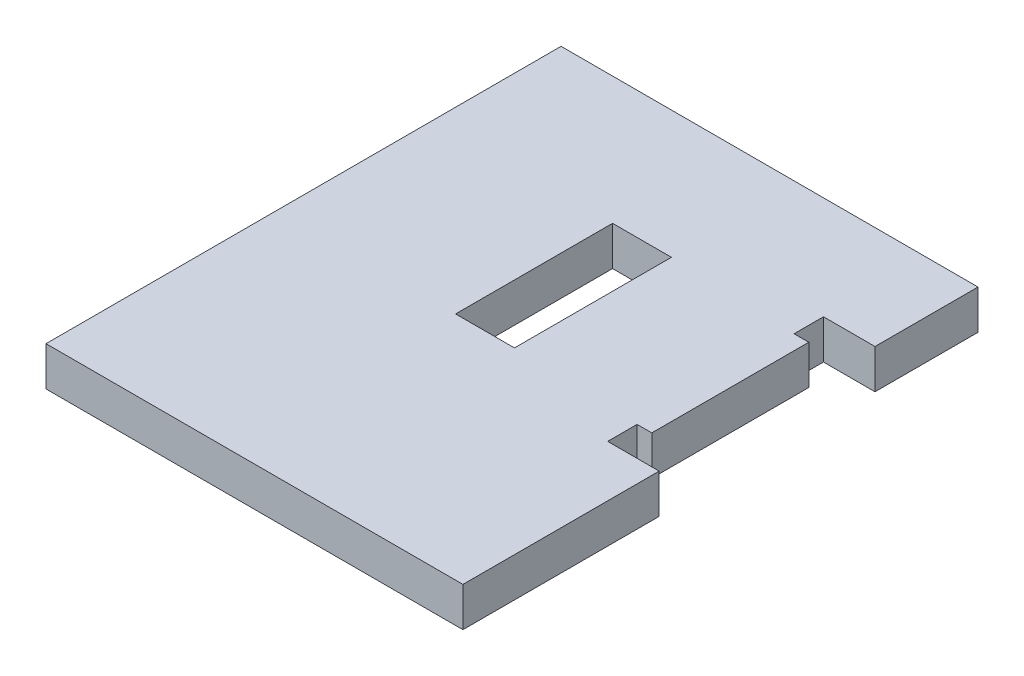
from build123d import *

# Parameters (mm, degrees)
SKETCH_1_W          = 17
SKETCH_1_H          = 21
EXTRUDE_1_DEPTH     = 1.6
SKETCH_2_W          = 2.4
SKETCH_2_H          = 6.4
CUT_EXTRUDE_1_DEPTH = 10
CUT_EXTRUDE_2_DEPTH = 10


with BuildPart() as part:
    # 草图1 → 凸台-拉伸1 (new body)
    with BuildSketch(Plane(origin=(0, 0, 0), x_dir=(1, 0, 0), z_dir=(0, 1, 0))):
        with Locations((-8.5, 10.5)):
            Rectangle(SKETCH_1_W, SKETCH_1_H)
    extrude(amount=EXTRUDE_1_DEPTH)

    # 草图2 → 切除-拉伸1 (cut)
    with BuildSketch(Plane(origin=(0, 1.6, 0), x_dir=(1, 0, 0), z_dir=(0, 1, 0))):
        with Locations((-8.5, 12.6)):
            Rectangle(SKETCH_2_W, SKETCH_2_H)
    extrude(amount=-CUT_EXTRUDE_1_DEPTH, mode=Mode.SUBTRACT)

    # 草图3 → 切除-拉伸2 (cut)
    with BuildSketch(Plane(origin=(0, 1.6, 0), x_dir=(1, 0, 0), z_dir=(0, 1, 0))):
        Polygon((0, 16.8), (-1.5, 16.8), (-2.1, 16.8), (-2.1, 15.6), (-1.5, 15.6), (-1.5, 9.2), (-2.1, 9.2), (-2.1, 8), (-1.5, 8), (0, 8), align=None)
    extrude(amount=-CUT_EXTRUDE_2_DEPTH, mode=Mode.SUBTRACT)


solid = part.part
